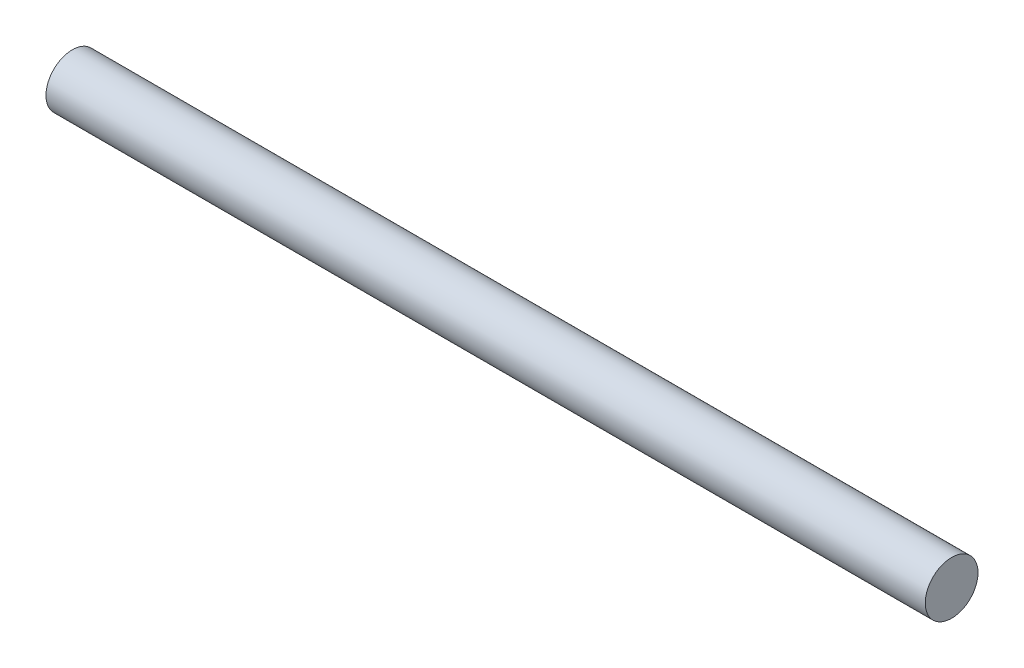
from build123d import *

# Parameters (mm, degrees)
SKETCH1_R           = 30
BOSS_EXTRUDE1_DEPTH = 1000


with BuildPart() as part:
    # Sketch1 → Boss-Extrude1 (new body)
    with BuildSketch(Plane(origin=(0, 0, 0), x_dir=(0, 0, -1), z_dir=(1, 0, 0))):
        Circle(SKETCH1_R)
    extrude(amount=BOSS_EXTRUDE1_DEPTH)


solid = part.part
